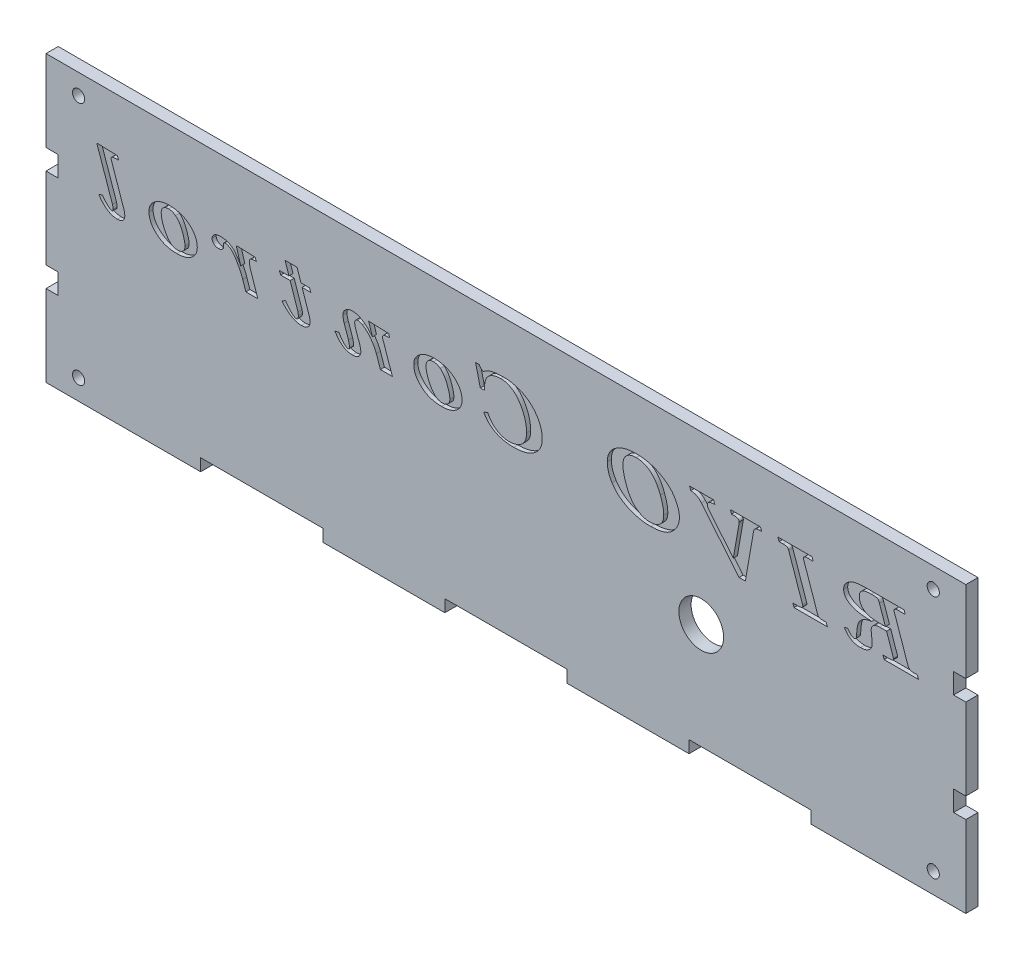
from build123d import *

# Parameters (mm, degrees)
SKETCH1_W           = 220
SKETCH1_H           = 70
BOSS_EXTRUDE1_DEPTH = 3
SKETCH2_R           = 1.5
CUT_EXTRUDE1_DEPTH  = 1
SKETCH2_2_R         = 1.5
CUT_EXTRUDE2_DEPTH  = 231.887418579
SKETCH3_W           = 3
SKETCH3_H           = 20
BOSS_EXTRUDE4_DEPTH = 3
LPATTERN1_COUNT     = 2
LPATTERN1_PITCH     = 25
LPATTERN1_COL_COUNT = 2
LPATTERN1_COL_PITCH = 25
SKETCH4_W           = 30
SKETCH4_H           = 3
CUT_EXTRUDE3_DEPTH  = 234.747727388
SKETCH5_R           = 5.5
CUT_EXTRUDE4_DEPTH  = 234.747727387


with BuildPart() as part:
    # Sketch1 → Boss-Extrude1 (new body)
    with BuildSketch(Plane.XY):
        with Locations((110, 35)):
            Rectangle(SKETCH1_W, SKETCH1_H)
    extrude(amount=BOSS_EXTRUDE1_DEPTH)

    # Sketch2 → Cut-Extrude1 (cut)
    # profile 1 of 15: a face of its own
    with BuildSketch(Plane.XY.offset(3)):
        with Locations((5, 65)):
            Circle(SKETCH2_R)
    # profile 2 of 15: a face of its own
    with BuildSketch(Plane.XY.offset(3)):
        with Locations((215, 65)):
            Circle(SKETCH2_R)
    # profile 3 of 15: a face of its own
    with BuildSketch(Plane.XY.offset(3)):
        with Locations((215, 5)):
            Circle(SKETCH2_R)
    # profile 4 of 15: a face of its own
    with BuildSketch(Plane.XY.offset(3)):
        with Locations((5, 5)):
            Circle(SKETCH2_R)
    # profile 5 of 15: a face of its own
    with BuildSketch(Plane.XY.offset(3)):
        with BuildLine():
            Line((14.551689621, 57.039686415), (9.471122698, 57.206861882))
            Line((9.471122698, 57.206861882), (13.323994786, 46.074020636))
            add(Edge.make_bspline(
                [(13.323994786, 46.074020636), (13.352411728, 45.96897658), (13.404520683, 45.776354301), (13.456120583, 45.508650843), (13.499697389, 45.291750303), (13.504672708, 45.161667665), (13.506842953, 45.104925351)],
                knots=[0, 0, 0, 0, 1.320580168, 2.421585475, 3.311492349, 4, 4, 4, 4], degree=3))
            add(Edge.make_bspline(
                [(13.506842953, 45.104925351), (13.50417644, 45.040964645), (13.499437044, 44.927282403), (13.44885079, 44.77796236), (13.345603216, 44.680755487), (13.260473983, 44.672782885), (13.216898003, 44.668701867)],
                knots=[0, 0, 0, 0, 1.297222036, 2.30565167, 3.132696397, 4, 4, 4, 4], degree=3))
            add(Edge.make_bspline(
                [(13.216898003, 44.668701867), (13.163404836, 44.673643167), (13.049421049, 44.68417214), (12.875234802, 44.745170253), (12.694402258, 44.847666007), (12.576819668, 44.935439912), (12.514238618, 44.982155868)],
                knots=[0, 0, 0, 0, 0.821691393, 1.750868447, 2.802943417, 4, 4, 4, 4], degree=3))
            add(Edge.make_bspline(
                [(12.514238618, 44.982155868), (12.375093113, 45.098833383), (12.083393549, 45.343431871), (11.675543968, 45.781980683), (11.251287255, 46.280217826), (10.984439974, 46.649269388), (10.845096066, 46.841982937)],
                knots=[0, 0, 0, 0, 0.868547279, 1.820790839, 2.862047544, 4, 4, 4, 4], degree=3))
            Line((10.845096066, 46.841982937), (9.962200632, 46.489347186))
            add(Edge.make_bspline(
                [(9.962200632, 46.489347186), (10.04913175, 46.361507738), (10.21930664, 46.111251391), (10.486554533, 45.755455925), (10.756138107, 45.42553014), (11.035993855, 45.127059823), (11.315294676, 44.852518688), (11.602231044, 44.608104761), (11.892174467, 44.391320491), (12.184819326, 44.199203824), (12.480940336, 44.036492108), (12.773432623, 43.890507439), (13.067318264, 43.770889868), (13.35907676, 43.670634817), (13.650116148, 43.595102744), (13.938860861, 43.539995719), (14.226003377, 43.503983944), (14.417497697, 43.500300931), (14.512507871, 43.498473599)],
                knots=[0, 0, 0, 0, 1.307275946, 2.559101335, 3.762156086, 4.908432785, 6.017614015, 7.072703534, 8.093310473, 9.077760244, 10.030439296, 10.949248196, 11.840831279, 12.711740014, 13.556543656, 14.38117705, 15.196818743, 16, 16, 16, 16], degree=3))
            add(Edge.make_bspline(
                [(14.512507871, 43.498473599), (14.649676191, 43.502651667), (14.911018427, 43.510612002), (15.279528765, 43.592987815), (15.603036915, 43.725697211), (15.876877332, 43.914898324), (16.09259209, 44.157414378), (16.247399147, 44.445219847), (16.340493998, 44.777120057), (16.351107101, 45.012872552), (16.356662239, 45.136270751)],
                knots=[0, 0, 0, 0, 1.175547938, 2.23973238, 3.220927403, 4.159988468, 5.07033707, 5.979795866, 6.942579371, 8, 8, 8, 8], degree=3))
            add(Edge.make_bspline(
                [(16.356662239, 45.136270751), (16.354376677, 45.247857916), (16.349824926, 45.470086386), (16.306162976, 45.800425154), (16.236498261, 46.125621279), (16.168639365, 46.336598987), (16.134632323, 46.442329086)],
                knots=[0, 0, 0, 0, 1.005668898, 2.002813329, 2.999122954, 4, 4, 4, 4], degree=3))
            Line((16.134632323, 46.442329086), (13.065395236, 55.320913646))
            add(Edge.make_bspline(
                [(13.065395236, 55.320913646), (13.039146411, 55.39239769), (12.990999581, 55.523517093), (12.979294723, 55.662554931), (12.973971152, 55.72579173)],
                knots=[0, 0, 0, 0, 1.090365615, 2, 2, 2, 2], degree=3))
            add(Edge.make_bspline(
                [(12.973971152, 55.72579173), (12.977724115, 55.762081711), (12.985150007, 55.833887766), (13.039302051, 55.934436356), (13.130818568, 56.015687331), (13.257746842, 56.085919811), (13.432464064, 56.139065205), (13.661059631, 56.179249092), (13.949668037, 56.200019899), (14.161589345, 56.202469967), (14.27741737, 56.203809081)],
                knots=[0, 0, 0, 0, 0.574062983, 1.135883696, 1.760787866, 2.490067691, 3.419720705, 4.640616689, 6.163890458, 8, 8, 8, 8], degree=3))
            Line((14.27741737, 56.203809081), (14.849470921, 56.203809081))
            Line((14.849470921, 56.203809081), (14.551689621, 57.039686415))
        make_face()
    # profile 6 of 15: a face of its own
    with BuildSketch(Plane.XY.offset(3)):
        with BuildLine():
            add(Edge.make_bspline(
                [(27.299341392, 52.860299743), (27.119006294, 52.856442777), (26.76635007, 52.848900246), (26.250028786, 52.800108785), (25.759460999, 52.713235054), (25.294187654, 52.594510965), (24.854761768, 52.439140975), (24.440753614, 52.251362113), (24.052234834, 52.028547866), (23.693254612, 51.77329749), (23.366956935, 51.492614199), (23.08097591, 51.190597449), (22.841650251, 50.867398906), (22.63896428, 50.530158652), (22.489098635, 50.169186222), (22.377369927, 49.792206917), (22.31093096, 49.396375346), (22.303510116, 49.126091566), (22.299750086, 48.989142839)],
                knots=[0, 0, 0, 0, 1.22563779, 2.396809051, 3.520493674, 4.608426224, 5.656521782, 6.684000592, 7.693965789, 8.695557622, 9.673104136, 10.615039748, 11.515697462, 12.401694697, 13.282061713, 14.164018342, 15.069735699, 16, 16, 16, 16], degree=3))
            add(Edge.make_bspline(
                [(22.299750086, 48.989142839), (22.304983851, 48.813757232), (22.315364051, 48.465912464), (22.407633188, 47.951841742), (22.558568699, 47.453555991), (22.762329469, 46.965501135), (23.031930648, 46.495105771), (23.358307753, 46.037449751), (23.745560832, 45.596473204), (24.182684459, 45.16992251), (24.669979428, 44.778754022), (25.197717418, 44.432625681), (25.766786747, 44.145824842), (26.370472338, 43.906987487), (27.013291377, 43.725204165), (27.69092997, 43.591729023), (28.406750768, 43.512845464), (28.896017975, 43.503334929), (29.146107877, 43.498473599)],
                knots=[0, 0, 0, 0, 0.863540575, 1.712672307, 2.563622542, 3.424890568, 4.31241331, 5.228986642, 6.18984498, 7.200063901, 8.234475782, 9.263688751, 10.303521339, 11.368585259, 12.457519362, 13.58991351, 14.768079515, 16, 16, 16, 16], degree=3))
            add(Edge.make_bspline(
                [(29.146107877, 43.498473599), (29.329047724, 43.502361625), (29.686903288, 43.509967138), (30.210259114, 43.558282688), (30.705639855, 43.646020099), (31.175818836, 43.761445792), (31.618722944, 43.91652423), (32.034687138, 44.104662803), (32.425197228, 44.324717466), (32.78326522, 44.579588588), (33.106663291, 44.860811699), (33.39152666, 45.162574073), (33.633860098, 45.483832009), (33.828079512, 45.827219114), (33.981426583, 46.188106811), (34.090942363, 46.568580721), (34.158304229, 46.968448538), (34.165533876, 47.241370539), (34.169208233, 47.380078971)],
                knots=[0, 0, 0, 0, 1.236531547, 2.418826196, 3.54791389, 4.63410273, 5.68753004, 6.714707205, 7.716191271, 8.712265994, 9.679982411, 10.608410966, 11.512344189, 12.392654912, 13.268172565, 14.156570212, 15.063105018, 16, 16, 16, 16], degree=3))
            add(Edge.make_bspline(
                [(34.169208233, 47.380078971), (34.165715794, 47.500336858), (34.158735954, 47.740679181), (34.117253016, 48.098401287), (34.043379697, 48.451466756), (33.93767615, 48.798322223), (33.806432844, 49.142422202), (33.648162154, 49.482551905), (33.45439646, 49.815009562), (33.237413753, 50.142138636), (32.993919217, 50.456558057), (32.734173837, 50.758432522), (32.450401428, 51.037760476), (32.149601488, 51.298525416), (31.833234231, 51.544025121), (31.493513019, 51.765270619), (31.137608663, 51.971728046), (30.762464337, 52.156463147), (30.374435914, 52.324384917), (29.971236032, 52.468044121), (29.554787155, 52.587786787), (29.126577468, 52.686550365), (28.687388906, 52.765863804), (28.235522617, 52.81948397), (27.771841794, 52.855156929), (27.45787782, 52.858574193), (27.299341392, 52.860299743)],
                knots=[0, 0, 0, 0, 0.888317552, 1.775353847, 2.655721043, 3.548890605, 4.450631694, 5.374125356, 6.316174758, 7.290042599, 8.271482707, 9.251552309, 10.229255916, 11.209325518, 12.190765627, 13.184267925, 14.201302937, 15.228051197, 16.270925968, 17.322567865, 18.387030847, 19.469658163, 20.567158265, 21.681505567, 22.829273875, 24, 24, 24, 24], degree=3))
        make_face()
        with BuildLine():
            add(Edge.make_bspline(
                [(27.147838625, 52.024422409), (27.224547179, 52.022245435), (27.376753691, 52.017925843), (27.601398285, 51.988589269), (27.81975543, 51.941195605), (28.032753464, 51.876320765), (28.239272879, 51.788931018), (28.440443951, 51.68463526), (28.636092034, 51.561398582), (28.757757506, 51.464862926), (28.819593294, 51.415799225)],
                knots=[0, 0, 0, 0, 1.013785412, 2.011571518, 2.988973338, 3.964544117, 4.949841126, 5.948423338, 6.957297764, 8, 8, 8, 8], degree=3))
            add(Edge.make_bspline(
                [(28.819593294, 51.415799225), (28.904360487, 51.342187864), (29.07657731, 51.192635729), (29.317195786, 50.940326337), (29.544483684, 50.658911326), (29.761752416, 50.35050125), (29.965064324, 50.011775987), (30.157398871, 49.645842171), (30.341536207, 49.253492391), (30.506062948, 48.839377633), (30.657592116, 48.423546451), (30.791197205, 48.021204768), (30.904513537, 47.639821353), (30.994656615, 47.27948832), (31.071401349, 46.941472166), (31.11867476, 46.62345724), (31.153566833, 46.327287124), (31.157945956, 46.13680242), (31.16004983, 46.045287352)],
                knots=[0, 0, 0, 0, 0.898298403, 1.825023227, 2.786175257, 3.791663527, 4.842322108, 5.945990988, 7.099669882, 8.309778945, 9.51140849, 10.642057629, 11.70283884, 12.695099624, 13.615117063, 14.475661657, 15.267658119, 16, 16, 16, 16], degree=3))
            add(Edge.make_bspline(
                [(31.16004983, 46.045287352), (31.158589278, 45.978181261), (31.155753432, 45.847886234), (31.132488744, 45.657781129), (31.090530506, 45.480255903), (31.033372016, 45.314466538), (30.959179019, 45.161394136), (30.870633138, 45.019712058), (30.764501162, 44.88976351), (30.60106744, 44.734481067), (30.363287382, 44.570757317), (30.035908868, 44.430919648), (29.66713415, 44.350554009), (29.408590239, 44.339895334), (29.274101594, 44.334350934)],
                knots=[0, 0, 0, 0, 0.837908338, 1.626905794, 2.38650819, 3.11211736, 3.812436167, 4.506309664, 5.194107319, 5.901648696, 7.316271823, 8.772613992, 10.321187426, 12, 12, 12, 12], degree=3))
            add(Edge.make_bspline(
                [(29.274101594, 44.334350934), (29.142096367, 44.338612722), (28.883118868, 44.346973808), (28.509407823, 44.43518718), (28.156570642, 44.569483528), (27.946052396, 44.703229118), (27.840049543, 44.770574418)],
                knots=[0, 0, 0, 0, 1.038900749, 2.038191385, 3.012164901, 4, 4, 4, 4], degree=3))
            add(Edge.make_bspline(
                [(27.840049543, 44.770574418), (27.764070075, 44.829353958), (27.607180612, 44.950727413), (27.385257982, 45.165125121), (27.16557275, 45.411563384), (26.949968672, 45.692007391), (26.735369527, 46.002680335), (26.527024401, 46.347736027), (26.317918937, 46.722387925), (26.118229088, 47.124916397), (25.929298074, 47.537765257), (25.764860873, 47.952241627), (25.622063244, 48.358305372), (25.510617078, 48.759410763), (25.421373734, 49.151625678), (25.354227378, 49.535786397), (25.317498881, 49.913976343), (25.311754654, 50.163653947), (25.30890849, 50.287364824)],
                knots=[0, 0, 0, 0, 0.739100351, 1.526163063, 2.371207367, 3.278957214, 4.247697677, 5.276630592, 6.380869678, 7.550018524, 8.735009959, 9.875225442, 10.981822192, 12.047165739, 13.07817094, 14.07770823, 15.047538117, 16, 16, 16, 16], degree=3))
            add(Edge.make_bspline(
                [(25.30890849, 50.287364824), (25.310428169, 50.353592145), (25.313397619, 50.483000205), (25.336056261, 50.671487697), (25.379272234, 50.848690285), (25.435663453, 51.015422878), (25.508860927, 51.170915521), (25.599997687, 51.313366696), (25.703257036, 51.448076424), (25.868214377, 51.605891101), (26.100239932, 51.776759545), (26.419718473, 51.920773328), (26.773019496, 52.009562334), (27.020172324, 52.019360952), (27.147838625, 52.024422409)],
                knots=[0, 0, 0, 0, 0.836317723, 1.634163236, 2.391584907, 3.13572098, 3.853811406, 4.555466211, 5.268148489, 5.991272321, 7.431866059, 8.883329201, 10.390089908, 12, 12, 12, 12], degree=3))
        make_face(mode=Mode.SUBTRACT)
    # profile 7 of 15: a face of its own
    with BuildSketch(Plane.XY.offset(3)):
        with BuildLine():
            Line((48.371808989, 52.358773343), (43.740526134, 52.52594881))
            Line((43.740526134, 52.52594881), (44.858512069, 48.743603872))
            add(Edge.make_bspline(
                [(44.858512069, 48.743603872), (44.767158385, 48.913043403), (44.59117947, 49.239442773), (44.321509651, 49.703097168), (44.05843721, 50.124519168), (43.799658991, 50.502945107), (43.550629038, 50.841656786), (43.304197189, 51.135201875), (43.06559273, 51.3881975), (42.899660726, 51.532775121), (42.821061066, 51.601259509)],
                knots=[0, 0, 0, 0, 1.308934308, 2.521461963, 3.646775877, 4.686328269, 5.638415768, 6.504164063, 7.291443531, 8, 8, 8, 8], degree=3))
            add(Edge.make_bspline(
                [(42.821061066, 51.601259509), (42.71341655, 51.675418515), (42.499160436, 51.823024924), (42.158098725, 52.009854168), (41.807232875, 52.169859451), (41.445328416, 52.30237897), (41.070369576, 52.39950042), (40.685977447, 52.474571917), (40.289072332, 52.515753368), (40.02095791, 52.522519059), (39.88504193, 52.52594881)],
                knots=[0, 0, 0, 0, 1.001788886, 1.993964955, 2.976955787, 3.956926391, 4.944802578, 5.943895814, 6.957693459, 8, 8, 8, 8], degree=3))
            add(Edge.make_bspline(
                [(39.88504193, 52.52594881), (39.734861482, 52.52253479), (39.448897506, 52.516034033), (39.044836004, 52.437630769), (38.684784931, 52.318390818), (38.425986894, 52.167434544), (38.243955066, 52.031445572), (38.129727971, 51.918516896), (38.031843983, 51.800773512), (37.951723722, 51.675450716), (37.888678492, 51.542222151), (37.844697672, 51.400631198), (37.817264447, 51.252304555), (37.814858902, 51.151226667), (37.813633411, 51.099733108)],
                knots=[0, 0, 0, 0, 1.923675167, 3.662938871, 5.259502594, 6.76535571, 7.482429017, 8.169564703, 8.820241742, 9.443000614, 10.072533134, 10.704833713, 11.340184861, 12, 12, 12, 12], degree=3))
            add(Edge.make_bspline(
                [(37.813633411, 51.099733108), (37.818627766, 51.002333856), (37.828436199, 50.811051069), (37.922174884, 50.538683308), (38.071755222, 50.292556438), (38.277269688, 50.08150626), (38.516078975, 49.905092629), (38.782926386, 49.77748738), (39.069096062, 49.698839457), (39.267212076, 49.688975936), (39.367842829, 49.683965873)],
                knots=[0, 0, 0, 0, 0.99890432, 1.961752269, 2.926264607, 3.93975457, 4.971478111, 5.964827329, 6.966257429, 8, 8, 8, 8], degree=3))
            add(Edge.make_bspline(
                [(39.367842829, 49.683965873), (39.454426604, 49.686939584), (39.622686361, 49.692718448), (39.864263917, 49.753353265), (40.087511667, 49.846708968), (40.283223856, 49.980085887), (40.449100675, 50.135650392), (40.567668066, 50.316616513), (40.642470273, 50.513343082), (40.651220701, 50.651550012), (40.655616347, 50.720976191)],
                knots=[0, 0, 0, 0, 1.131157922, 2.198198871, 3.239797426, 4.282953722, 5.282420346, 6.195990057, 7.093782652, 8, 8, 8, 8], degree=3))
            add(Edge.make_bspline(
                [(40.655616347, 50.720976191), (40.655616347, 50.807176041), (40.655616347, 50.990024208), (40.655616347, 51.172872375), (40.655616347, 51.269520692)],
                knots=[0, 0, 0, 0, 0.942857143, 2, 2, 2, 2], degree=3))
            add(Edge.make_bspline(
                [(40.655616347, 51.269520692), (40.655616347, 51.299995386), (40.655616347, 51.353108425), (40.655616347, 51.406221464), (40.655616347, 51.428859809)],
                knots=[0, 0, 0, 0, 1.147540984, 2, 2, 2, 2], degree=3))
            add(Edge.make_bspline(
                [(40.655616347, 51.428859809), (40.660999079, 51.462811723), (40.672737416, 51.536852002), (40.768309261, 51.616447851), (40.886827897, 51.679943678), (40.981941437, 51.686590122), (41.031761148, 51.690071475)],
                knots=[0, 0, 0, 0, 0.800238869, 1.74511248, 2.818907986, 4, 4, 4, 4], degree=3))
            add(Edge.make_bspline(
                [(41.031761148, 51.690071475), (41.114964897, 51.685299538), (41.290395055, 51.675238192), (41.560222868, 51.593893115), (41.850257511, 51.47253352), (42.10477411, 51.336124384), (42.319536836, 51.196138718), (42.485775412, 51.053973843), (42.661740392, 50.889926657), (42.841528282, 50.695433893), (43.02659804, 50.472005352), (43.219343845, 50.222708292), (43.415530669, 49.943631831), (43.545145291, 49.747009045), (43.612532417, 49.644784123)],
                knots=[0, 0, 0, 0, 0.873552962, 1.841834489, 2.941761573, 4.178677339, 4.87181004, 5.632499255, 6.474396829, 7.400611742, 8.414469194, 9.524067736, 10.712753556, 12, 12, 12, 12], degree=3))
            add(Edge.make_bspline(
                [(43.612532417, 49.644784123), (43.790896977, 49.355036281), (44.143264586, 48.782625738), (44.607265841, 47.900736316), (45.011600593, 47.014593293), (45.230689296, 46.411662365), (45.339141536, 46.113202386)],
                knots=[0, 0, 0, 0, 1.036059318, 2.046784102, 3.033128423, 4, 4, 4, 4], degree=3))
            Line((45.339141536, 46.113202386), (46.109715954, 43.832824533))
            Line((46.109715954, 43.832824533), (49.048347207, 43.832824533))
            Line((49.048347207, 43.832824533), (47.436671222, 48.568592055))
            add(Edge.make_bspline(
                [(47.436671222, 48.568592055), (47.399383178, 48.676325921), (47.327229902, 48.884793586), (47.234236909, 49.19111426), (47.151350485, 49.478692502), (47.086741179, 49.750934771), (47.033822275, 50.005063993), (46.996331008, 50.242088598), (46.974787303, 50.461974738), (46.970947509, 50.603390293), (46.969102338, 50.671345974)],
                knots=[0, 0, 0, 0, 1.264741701, 2.447306107, 3.55134569, 4.584650432, 5.550886558, 6.43078146, 7.245929383, 8, 8, 8, 8], degree=3))
            add(Edge.make_bspline(
                [(46.969102338, 50.671345974), (46.972958673, 50.75437591), (46.980093193, 50.907987725), (47.035376739, 51.120843499), (47.139127309, 51.288863091), (47.262538223, 51.391810524), (47.384565778, 51.448949409), (47.500067663, 51.488005237), (47.639613049, 51.517739528), (47.801805036, 51.543461997), (47.987391835, 51.564665266), (48.197541583, 51.576173173), (48.430945505, 51.584940499), (48.59470004, 51.583648172), (48.680038756, 51.582974692)],
                knots=[0, 0, 0, 0, 1.329184474, 2.459094287, 3.480297262, 4.440682147, 4.983170159, 5.631288918, 6.388922003, 7.264501657, 8.260652442, 9.378194237, 10.6336773, 12, 12, 12, 12], degree=3))
            Line((48.680038756, 51.582974692), (48.371808989, 52.358773343))
        make_face()
    # profile 8 of 15: a face of its own
    with BuildSketch(Plane.XY.offset(3)):
        with BuildLine():
            Line((58.674519558, 55.367931746), (55.738500421, 55.367931746))
            Line((55.738500421, 55.367931746), (56.694535122, 52.52594881))
            Line((56.694535122, 52.52594881), (54.317508953, 52.52594881))
            Line((54.317508953, 52.52594881), (54.67275682, 51.690071475))
            Line((54.67275682, 51.690071475), (56.979255839, 51.690071475))
            Line((56.979255839, 51.690071475), (58.906997941, 45.972148086))
            add(Edge.make_bspline(
                [(58.906997941, 45.972148086), (58.933327063, 45.843722621), (58.984761684, 45.592840147), (58.993941373, 45.336932135), (58.998422025, 45.212022135)],
                knots=[0, 0, 0, 0, 1.023789842, 2, 2, 2, 2], degree=3))
            add(Edge.make_bspline(
                [(58.998422025, 45.212022135), (58.997469261, 45.143111962), (58.995688173, 45.014291934), (58.968703256, 44.83486333), (58.929722942, 44.68130606), (58.868818364, 44.555450711), (58.793323661, 44.456802318), (58.704379817, 44.386371451), (58.603742211, 44.340362955), (58.53134967, 44.336386793), (58.494283508, 44.334350934)],
                knots=[0, 0, 0, 0, 1.464318973, 2.73738411, 3.851806852, 4.821004614, 5.691751274, 6.46990972, 7.216568822, 8, 8, 8, 8], degree=3))
            add(Edge.make_bspline(
                [(58.494283508, 44.334350934), (58.454953896, 44.336695308), (58.373602342, 44.341544543), (58.24867027, 44.372146074), (58.118736049, 44.422718844), (57.981319812, 44.491644549), (57.838778881, 44.581020383), (57.688720711, 44.689217166), (57.533143839, 44.81718302), (57.370295815, 44.964640086), (57.201580691, 45.131413891), (57.02567544, 45.317943003), (56.84418045, 45.524721613), (56.652048353, 45.747742734), (56.460764891, 45.996214992), (56.255363139, 46.258329337), (56.047601218, 46.543210259), (55.908850138, 46.740765349), (55.837760855, 46.841982937)],
                knots=[0, 0, 0, 0, 0.504540702, 1.043620015, 1.64097657, 2.29025811, 3.012387114, 3.796535341, 4.661675592, 5.59472022, 6.613458126, 7.703695725, 8.882486672, 10.142292464, 11.478349101, 12.903525385, 14.413517499, 16, 16, 16, 16], degree=3))
            Line((55.837760855, 46.841982937), (54.999271404, 46.345680769))
            add(Edge.make_bspline(
                [(54.999271404, 46.345680769), (55.09225914, 46.226413823), (55.275208597, 45.991761127), (55.56243398, 45.66089734), (55.853083524, 45.354536942), (56.145867605, 45.071090678), (56.442848276, 44.812510716), (56.744331697, 44.579636652), (57.047871978, 44.369059985), (57.355649529, 44.184435705), (57.662972792, 44.022916598), (57.967444042, 43.883679358), (58.268207767, 43.76563934), (58.566453885, 43.66852208), (58.862201076, 43.5925146), (59.154323739, 43.536978431), (59.443490745, 43.504759245), (59.634831786, 43.500558751), (59.729814692, 43.498473599)],
                knots=[0, 0, 0, 0, 1.269902568, 2.498479848, 3.677781506, 4.81549835, 5.919560655, 6.982892565, 8.013280144, 9.020284053, 9.994990875, 10.927561575, 11.830565535, 12.706975986, 13.56004427, 14.393295013, 15.202421454, 16, 16, 16, 16], degree=3))
            add(Edge.make_bspline(
                [(59.729814692, 43.498473599), (59.810867904, 43.499802328), (59.968976611, 43.502394249), (60.199110265, 43.527632589), (60.417409861, 43.561652053), (60.621063481, 43.618361957), (60.813376979, 43.68492341), (60.990952673, 43.769754511), (61.158277149, 43.865612708), (61.307814003, 43.981284098), (61.444696147, 44.105920204), (61.563136998, 44.242645456), (61.662507417, 44.389385755), (61.744027262, 44.54442503), (61.807945878, 44.708157557), (61.850587068, 44.88127351), (61.882131987, 45.062864225), (61.883904769, 45.18749672), (61.884810945, 45.251203885)],
                knots=[0, 0, 0, 0, 1.244383984, 2.427392293, 3.553073846, 4.633352713, 5.669692395, 6.674754656, 7.651845416, 8.625452123, 9.57185877, 10.491525084, 11.396587146, 12.287909707, 13.17702229, 14.088484109, 15.022909239, 16, 16, 16, 16], degree=3))
            add(Edge.make_bspline(
                [(61.884810945, 45.251203885), (61.882492457, 45.350627684), (61.877774629, 45.552942497), (61.832194676, 45.857269433), (61.769023028, 46.169037101), (61.70391358, 46.374054993), (61.670617378, 46.47889872)],
                knots=[0, 0, 0, 0, 0.952779933, 1.938786236, 2.945919648, 4, 4, 4, 4], degree=3))
            Line((61.670617378, 46.47889872), (59.915274976, 51.690071475))
            Line((59.915274976, 51.690071475), (62.096392395, 51.690071475))
            Line((62.096392395, 51.690071475), (61.743756645, 52.52594881))
            Line((61.743756645, 52.52594881), (59.633166376, 52.52594881))
            Line((59.633166376, 52.52594881), (58.674519558, 55.367931746))
        make_face()
    # profile 9 of 15: a face of its own
    with BuildSketch(Plane.XY.offset(3)):
        with BuildLine():
            Line((68.961557426, 46.67480747), (68.005522725, 46.431880619))
            add(Edge.make_bspline(
                [(68.005522725, 46.431880619), (68.075550198, 46.308291573), (68.212855889, 46.065965546), (68.438162292, 45.723286647), (68.673454949, 45.407964083), (68.914411945, 45.115450286), (69.164810083, 44.848361475), (69.426208809, 44.607801729), (69.696500864, 44.392990824), (69.972552402, 44.201648579), (70.256072397, 44.037622687), (70.540648785, 43.894403498), (70.825247476, 43.76875546), (71.115037411, 43.674289961), (71.403776628, 43.593749895), (71.694953025, 43.54031289), (71.986321488, 43.503685363), (72.181313412, 43.500212472), (72.278945597, 43.498473599)],
                knots=[0, 0, 0, 0, 1.251828656, 2.454510936, 3.611869784, 4.718336289, 5.793346919, 6.836207262, 7.846623055, 8.834400209, 9.793987353, 10.730996468, 11.641997258, 12.532696194, 13.415156968, 14.282164015, 15.13988192, 16, 16, 16, 16], degree=3))
            add(Edge.make_bspline(
                [(72.278945597, 43.498473599), (72.358221626, 43.500140602), (72.512700459, 43.503388958), (72.738053877, 43.523896502), (72.950448448, 43.560068455), (73.148680442, 43.612265538), (73.334180756, 43.678104335), (73.506645591, 43.757863801), (73.663997233, 43.856071994), (73.808392124, 43.965258445), (73.936528269, 44.087877413), (74.047074522, 44.222579811), (74.141592701, 44.367112823), (74.220774192, 44.52165599), (74.28069917, 44.686757923), (74.32221601, 44.862101259), (74.349442079, 45.047472851), (74.351773725, 45.175352218), (74.352966233, 45.240755418)],
                knots=[0, 0, 0, 0, 1.242169857, 2.420516678, 3.541968653, 4.614123133, 5.628197633, 6.623000552, 7.584697459, 8.528815158, 9.455120532, 10.356475475, 11.253276, 12.1562814, 13.071265288, 13.997771574, 14.975971268, 16, 16, 16, 16], degree=3))
            add(Edge.make_bspline(
                [(74.352966233, 45.240755418), (74.35131924, 45.303512353), (74.347855019, 45.435512916), (74.322102681, 45.643007881), (74.283592332, 45.870873827), (74.223796864, 46.118371145), (74.15385306, 46.387876263), (74.068149659, 46.67760366), (73.961766142, 46.985614501), (73.885635916, 47.197318916), (73.846215599, 47.306939704)],
                knots=[0, 0, 0, 0, 0.704730607, 1.482303691, 2.345668163, 3.299301438, 4.340616617, 5.473090934, 6.691563596, 8, 8, 8, 8], degree=3))
            add(Edge.make_bspline(
                [(73.846215599, 47.306939704), (73.787920353, 47.468035294), (73.677328928, 47.773648396), (73.519896707, 48.206695077), (73.383876688, 48.591799565), (73.267102241, 48.928157368), (73.166180083, 49.215510976), (73.088610273, 49.455540339), (73.028331016, 49.646152631), (72.971604266, 49.832217387), (72.92704587, 50.02877214), (72.882815852, 50.245096535), (72.85880751, 50.449635887), (72.855301279, 50.581611937), (72.853611264, 50.645224808)],
                knots=[0, 0, 0, 0, 1.764122366, 3.346701849, 4.744723696, 5.969679202, 7.013120823, 7.880732494, 8.566961968, 9.071926962, 9.88308229, 10.640954182, 11.344935645, 12, 12, 12, 12], degree=3))
            add(Edge.make_bspline(
                [(72.853611264, 50.645224808), (72.85579943, 50.709903154), (72.859984418, 50.833604087), (72.900115893, 51.00735931), (72.962112915, 51.161612162), (73.054488651, 51.289543786), (73.165227386, 51.390932889), (73.286671439, 51.472027116), (73.427568324, 51.512888067), (73.524716555, 51.519502617), (73.574555465, 51.522896009)],
                knots=[0, 0, 0, 0, 1.217555655, 2.328642857, 3.343917921, 4.332429815, 5.273312955, 6.165988551, 7.05911686, 8, 8, 8, 8], degree=3))
            add(Edge.make_bspline(
                [(73.574555465, 51.522896009), (73.670751222, 51.518201151), (73.867362071, 51.508605511), (74.164598155, 51.432552965), (74.469090042, 51.31197485), (74.665950296, 51.199828778), (74.768292783, 51.141526975)],
                knots=[0, 0, 0, 0, 0.909343586, 1.858572773, 2.886728108, 4, 4, 4, 4], degree=3))
            add(Edge.make_bspline(
                [(74.768292783, 51.141526975), (74.855944673, 51.087576679), (75.033515686, 50.978280589), (75.292517717, 50.795248031), (75.545411169, 50.589958465), (75.79744219, 50.367884351), (76.044440942, 50.124134782), (76.291202827, 49.86351452), (76.530410394, 49.580091569), (76.844636678, 49.183364476), (77.209742222, 48.670220746), (77.586962531, 48.031831119), (77.918419657, 47.390512121), (78.086291975, 46.946512169), (78.169268687, 46.727049803)],
                knots=[0, 0, 0, 0, 0.653204802, 1.323305622, 2.011220133, 2.719868556, 3.45460932, 4.213118867, 4.997210866, 5.807698757, 7.425449128, 8.989361705, 10.511887675, 12, 12, 12, 12], degree=3))
            Line((78.169268687, 46.727049803), (79.164485138, 43.832824533))
            Line((79.164485138, 43.832824533), (82.105728508, 43.832824533))
            Line((82.105728508, 43.832824533), (79.720865989, 50.726200424))
            add(Edge.make_bspline(
                [(79.720865989, 50.726200424), (79.710631225, 50.771285214), (79.690715038, 50.859017286), (79.688153605, 50.948929336), (79.686908472, 50.992636325)],
                knots=[0, 0, 0, 0, 1.027783523, 2, 2, 2, 2], degree=3))
            add(Edge.make_bspline(
                [(79.686908472, 50.992636325), (79.690033342, 51.046020031), (79.695980665, 51.147621092), (79.738017876, 51.291824642), (79.813269946, 51.414584281), (79.920181582, 51.519546282), (80.07064299, 51.59955041), (80.267883146, 51.653946767), (80.515649718, 51.686084063), (80.69768711, 51.68866344), (80.797058057, 51.690071475)],
                knots=[0, 0, 0, 0, 0.855917329, 1.62900093, 2.380987736, 3.14135528, 4.003967099, 5.082005799, 6.407119304, 8, 8, 8, 8], degree=3))
            Line((80.797058057, 51.690071475), (81.379560074, 51.690071475))
            Line((81.379560074, 51.690071475), (81.285523874, 52.52594881))
            Line((81.285523874, 52.52594881), (76.275484101, 52.693124277))
            Line((76.275484101, 52.693124277), (77.210621869, 49.822408057))
            add(Edge.make_bspline(
                [(77.210621869, 49.822408057), (77.108657915, 49.94583351), (76.90850535, 50.188114436), (76.600981029, 50.533185025), (76.290814883, 50.851195646), (75.987419635, 51.150900481), (75.679640741, 51.421415744), (75.378382126, 51.674174748), (75.074134403, 51.898996395), (74.771427139, 52.100083699), (74.470306885, 52.279024086), (74.16946405, 52.433732889), (73.86918901, 52.564259511), (73.570186138, 52.672608748), (73.272376967, 52.755909643), (72.975875864, 52.81759383), (72.679377883, 52.851277301), (72.481895278, 52.857297878), (72.383430264, 52.860299743)],
                knots=[0, 0, 0, 0, 1.304719421, 2.561129976, 3.765564543, 4.924769583, 6.035615979, 7.104108714, 8.12881763, 9.116823579, 10.064878729, 10.982076299, 11.871936912, 12.7316337, 13.571868498, 14.390182196, 15.197343309, 16, 16, 16, 16], degree=3))
            add(Edge.make_bspline(
                [(72.383430264, 52.860299743), (72.296271051, 52.859294841), (72.124929374, 52.857319358), (71.87529972, 52.827112678), (71.637279543, 52.781949382), (71.410379006, 52.724657512), (71.19684748, 52.64156383), (70.996036658, 52.542432996), (70.80613681, 52.427530427), (70.632328698, 52.293927684), (70.472846854, 52.149074929), (70.334302902, 51.991747904), (70.21517125, 51.826050236), (70.117641984, 51.651075708), (70.045452725, 51.465841515), (69.988484136, 51.274140396), (69.957486889, 51.071139634), (69.953554846, 50.932653496), (69.951549644, 50.862030491)],
                knots=[0, 0, 0, 0, 1.188682088, 2.336767115, 3.425009085, 4.494209848, 5.524683847, 6.544900694, 7.547460688, 8.547906318, 9.531775706, 10.482961838, 11.402836684, 12.312215969, 13.207987815, 14.11051082, 15.036427727, 16, 16, 16, 16], degree=3))
            add(Edge.make_bspline(
                [(69.951549644, 50.862030491), (69.956291741, 50.74168159), (69.966166829, 50.491063365), (70.027136753, 50.101184521), (70.126442295, 49.683886188), (70.219326821, 49.400364358), (70.267615761, 49.252966623)],
                knots=[0, 0, 0, 0, 0.877134263, 1.826571168, 2.8700747, 4, 4, 4, 4], degree=3))
            Line((70.267615761, 49.252966623), (71.317686662, 46.225523403))
            add(Edge.make_bspline(
                [(71.317686662, 46.225523403), (71.340555711, 46.134157658), (71.384040743, 45.960427552), (71.442335109, 45.712410779), (71.487177169, 45.490397562), (71.531443548, 45.296237675), (71.562540937, 45.128019686), (71.583604048, 44.985060918), (71.597623676, 44.869217009), (71.600970563, 44.800202367), (71.602407379, 44.770574418)],
                knots=[0, 0, 0, 0, 1.522723292, 2.895427374, 4.118505542, 5.184273336, 6.114739369, 6.88319294, 7.520555329, 8, 8, 8, 8], degree=3))
            add(Edge.make_bspline(
                [(71.602407379, 44.770574418), (71.599622502, 44.706422939), (71.594665785, 44.592241704), (71.532673304, 44.441630783), (71.414191301, 44.348385584), (71.320120845, 44.339186721), (71.270668562, 44.334350934)],
                knots=[0, 0, 0, 0, 1.237335309, 2.20229488, 3.054957031, 4, 4, 4, 4], degree=3))
            add(Edge.make_bspline(
                [(71.270668562, 44.334350934), (71.202119689, 44.338975573), (71.059573332, 44.348592441), (70.847900339, 44.429404273), (70.63009847, 44.551197354), (70.494114134, 44.661976992), (70.421730645, 44.720944201)],
                knots=[0, 0, 0, 0, 0.862114692, 1.79275459, 2.825099066, 4, 4, 4, 4], degree=3))
            add(Edge.make_bspline(
                [(70.421730645, 44.720944201), (70.294537515, 44.842951169), (70.027462452, 45.099136536), (69.662131782, 45.555497401), (69.297927727, 46.083098667), (69.076961008, 46.471801096), (68.961557426, 46.67480747)],
                knots=[0, 0, 0, 0, 0.862485891, 1.811013488, 2.856765018, 4, 4, 4, 4], degree=3))
        make_face()
    # profile 10 of 15: a face of its own
    with BuildSketch(Plane.XY.offset(3)):
        with BuildLine():
            add(Edge.make_bspline(
                [(92.364033093, 52.860299743), (92.183697995, 52.856442777), (91.831041771, 52.848900246), (91.314720487, 52.800108785), (90.8241527, 52.713235054), (90.358879355, 52.594510965), (89.919453469, 52.439140975), (89.505445315, 52.251362113), (89.116926535, 52.028547866), (88.757946313, 51.77329749), (88.431648636, 51.492614199), (88.145667611, 51.190597449), (87.906341952, 50.867398906), (87.703655982, 50.530158652), (87.553790336, 50.169186222), (87.442061628, 49.792206917), (87.375622661, 49.396375346), (87.368201817, 49.126091566), (87.364441787, 48.989142839)],
                knots=[0, 0, 0, 0, 1.22563779, 2.396809051, 3.520493674, 4.608426224, 5.656521782, 6.684000592, 7.693965789, 8.695557622, 9.673104136, 10.615039748, 11.515697462, 12.401694697, 13.282061713, 14.164018342, 15.069735699, 16, 16, 16, 16], degree=3))
            add(Edge.make_bspline(
                [(87.364441787, 48.989142839), (87.369675552, 48.813757232), (87.380055752, 48.465912464), (87.472324889, 47.951841742), (87.6232604, 47.453555991), (87.82702117, 46.965501135), (88.096622349, 46.495105771), (88.422999454, 46.037449751), (88.810252533, 45.596473204), (89.24737616, 45.16992251), (89.734671129, 44.778754022), (90.26240912, 44.432625681), (90.831478448, 44.145824842), (91.43516404, 43.906987487), (92.077983078, 43.725204165), (92.755621671, 43.591729023), (93.471442469, 43.512845464), (93.960709676, 43.503334929), (94.210799579, 43.498473599)],
                knots=[0, 0, 0, 0, 0.863540575, 1.712672307, 2.563622542, 3.424890568, 4.31241331, 5.228986642, 6.18984498, 7.200063901, 8.234475782, 9.263688751, 10.303521339, 11.368585259, 12.457519362, 13.58991351, 14.768079515, 16, 16, 16, 16], degree=3))
            add(Edge.make_bspline(
                [(94.210799579, 43.498473599), (94.393739426, 43.502361625), (94.751594989, 43.509967138), (95.274950815, 43.558282688), (95.770331557, 43.646020099), (96.240510537, 43.761445792), (96.683414645, 43.91652423), (97.099378839, 44.104662803), (97.489888929, 44.324717466), (97.847956922, 44.579588588), (98.171354992, 44.860811699), (98.456218361, 45.162574073), (98.698551799, 45.483832009), (98.892771213, 45.827219114), (99.046118284, 46.188106811), (99.155634065, 46.568580721), (99.22299593, 46.968448538), (99.230225577, 47.241370539), (99.233899934, 47.380078971)],
                knots=[0, 0, 0, 0, 1.236531547, 2.418826196, 3.54791389, 4.63410273, 5.68753004, 6.714707205, 7.716191271, 8.712265994, 9.679982411, 10.608410966, 11.512344189, 12.392654912, 13.268172565, 14.156570212, 15.063105018, 16, 16, 16, 16], degree=3))
            add(Edge.make_bspline(
                [(99.233899934, 47.380078971), (99.230407496, 47.500336858), (99.223427655, 47.740679181), (99.181944717, 48.098401287), (99.108071398, 48.451466756), (99.002367851, 48.798322223), (98.871124545, 49.142422202), (98.712853855, 49.482551905), (98.519088161, 49.815009562), (98.302105454, 50.142138636), (98.058610918, 50.456558057), (97.798865538, 50.758432522), (97.515093129, 51.037760476), (97.214293189, 51.298525416), (96.897925932, 51.544025121), (96.55820472, 51.765270619), (96.202300365, 51.971728046), (95.827156038, 52.156463147), (95.439127615, 52.324384917), (95.035927733, 52.468044121), (94.619478856, 52.587786787), (94.19126917, 52.686550365), (93.752080607, 52.765863804), (93.300214319, 52.81948397), (92.836533495, 52.855156929), (92.522569521, 52.858574193), (92.364033093, 52.860299743)],
                knots=[0, 0, 0, 0, 0.888317552, 1.775353847, 2.655721043, 3.548890605, 4.450631694, 5.374125356, 6.316174758, 7.290042599, 8.271482707, 9.251552309, 10.229255916, 11.209325518, 12.190765627, 13.184267925, 14.201302937, 15.228051197, 16.270925968, 17.322567865, 18.387030847, 19.469658163, 20.567158265, 21.681505567, 22.829273875, 24, 24, 24, 24], degree=3))
        make_face()
        with BuildLine():
            add(Edge.make_bspline(
                [(92.212530326, 52.024422409), (92.28923888, 52.022245435), (92.441445392, 52.017925843), (92.666089987, 51.988589269), (92.884447131, 51.941195605), (93.097445165, 51.876320765), (93.30396458, 51.788931018), (93.505135652, 51.68463526), (93.700783736, 51.561398582), (93.822449207, 51.464862926), (93.884284995, 51.415799225)],
                knots=[0, 0, 0, 0, 1.013785412, 2.011571518, 2.988973338, 3.964544117, 4.949841126, 5.948423338, 6.957297764, 8, 8, 8, 8], degree=3))
            add(Edge.make_bspline(
                [(93.884284995, 51.415799225), (93.969052188, 51.342187864), (94.141269011, 51.192635729), (94.381887487, 50.940326337), (94.609175385, 50.658911326), (94.826444118, 50.35050125), (95.029756025, 50.011775987), (95.222090572, 49.645842171), (95.406227909, 49.253492391), (95.570754649, 48.839377633), (95.722283818, 48.423546451), (95.855888907, 48.021204768), (95.969205238, 47.639821353), (96.059348316, 47.27948832), (96.136093051, 46.941472166), (96.183366461, 46.62345724), (96.218258534, 46.327287124), (96.222637657, 46.13680242), (96.224741531, 46.045287352)],
                knots=[0, 0, 0, 0, 0.898298403, 1.825023227, 2.786175257, 3.791663527, 4.842322108, 5.945990988, 7.099669882, 8.309778945, 9.51140849, 10.642057629, 11.70283884, 12.695099624, 13.615117063, 14.475661657, 15.267658119, 16, 16, 16, 16], degree=3))
            add(Edge.make_bspline(
                [(96.224741531, 46.045287352), (96.22328098, 45.978181261), (96.220445133, 45.847886234), (96.197180445, 45.657781129), (96.155222208, 45.480255903), (96.098063718, 45.314466538), (96.02387072, 45.161394136), (95.935324839, 45.019712058), (95.829192863, 44.88976351), (95.665759141, 44.734481067), (95.427979083, 44.570757317), (95.100600569, 44.430919648), (94.731825852, 44.350554009), (94.47328194, 44.339895334), (94.338793295, 44.334350934)],
                knots=[0, 0, 0, 0, 0.837908338, 1.626905794, 2.38650819, 3.11211736, 3.812436167, 4.506309664, 5.194107319, 5.901648696, 7.316271823, 8.772613992, 10.321187426, 12, 12, 12, 12], degree=3))
            add(Edge.make_bspline(
                [(94.338793295, 44.334350934), (94.206788068, 44.338612722), (93.947810569, 44.346973808), (93.574099524, 44.43518718), (93.221262343, 44.569483528), (93.010744098, 44.703229118), (92.904741244, 44.770574418)],
                knots=[0, 0, 0, 0, 1.038900749, 2.038191385, 3.012164901, 4, 4, 4, 4], degree=3))
            add(Edge.make_bspline(
                [(92.904741244, 44.770574418), (92.828761776, 44.829353958), (92.671872313, 44.950727413), (92.449949683, 45.165125121), (92.230264451, 45.411563384), (92.014660373, 45.692007391), (91.800061228, 46.002680335), (91.591716102, 46.347736027), (91.382610639, 46.722387925), (91.182920789, 47.124916397), (90.993989775, 47.537765257), (90.829552574, 47.952241627), (90.686754946, 48.358305372), (90.57530878, 48.759410763), (90.486065435, 49.151625678), (90.418919079, 49.535786397), (90.382190582, 49.913976343), (90.376446355, 50.163653947), (90.373600191, 50.287364824)],
                knots=[0, 0, 0, 0, 0.739100351, 1.526163063, 2.371207367, 3.278957214, 4.247697677, 5.276630592, 6.380869678, 7.550018524, 8.735009959, 9.875225442, 10.981822192, 12.047165739, 13.07817094, 14.07770823, 15.047538117, 16, 16, 16, 16], degree=3))
            add(Edge.make_bspline(
                [(90.373600191, 50.287364824), (90.37511987, 50.353592145), (90.37808932, 50.483000205), (90.400747962, 50.671487697), (90.443963935, 50.848690285), (90.500355154, 51.015422878), (90.573552628, 51.170915521), (90.664689388, 51.313366696), (90.767948738, 51.448076424), (90.932906078, 51.605891101), (91.164931633, 51.776759545), (91.484410175, 51.920773328), (91.837711197, 52.009562334), (92.084864025, 52.019360952), (92.212530326, 52.024422409)],
                knots=[0, 0, 0, 0, 0.836317723, 1.634163236, 2.391584907, 3.13572098, 3.853811406, 4.555466211, 5.268148489, 5.991272321, 7.431866059, 8.883329201, 10.390089908, 12, 12, 12, 12], degree=3))
        make_face(mode=Mode.SUBTRACT)
    # profile 11 of 15: a face of its own
    with BuildSketch(Plane.XY.offset(3)):
        with BuildLine():
            add(Edge.make_bspline(
                [(104.44820723, 56.052306314), (104.342042085, 56.10759598), (104.132532678, 56.216706226), (103.864102999, 56.448069828), (103.635267072, 56.720775005), (103.524972434, 56.931900215), (103.468663479, 57.039686415)],
                knots=[0, 0, 0, 0, 1.009061938, 1.991312364, 2.974500448, 4, 4, 4, 4], degree=3))
            Line((103.468663479, 57.039686415), (102.543974178, 57.039686415))
            Line((102.543974178, 57.039686415), (103.714202446, 52.191597876))
            Line((103.714202446, 52.191597876), (104.717255247, 52.191597876))
            add(Edge.make_bspline(
                [(104.717255247, 52.191597876), (104.720017454, 52.344857414), (104.725340259, 52.640190347), (104.744658764, 53.067295238), (104.781174283, 53.460295006), (104.830164565, 53.820434262), (104.89277848, 54.147414232), (104.965557993, 54.442804122), (105.058799433, 54.70292901), (105.160175658, 54.934990892), (105.28162441, 55.142120946), (105.415114687, 55.335980886), (105.56361929, 55.52027063), (105.73177918, 55.688575987), (105.912586459, 55.847953414), (106.11234457, 55.98970899), (106.32509425, 56.124796092), (106.632478739, 56.288480865), (107.051716054, 56.456891368), (107.593154743, 56.60361874), (108.179030889, 56.68986523), (108.583768081, 56.700077458), (108.792157252, 56.705335481)],
                knots=[0, 0, 0, 0, 1.305064466, 2.514874571, 3.639072435, 4.664404757, 5.607983338, 6.47282425, 7.251248142, 7.95803604, 8.62559682, 9.291839122, 9.961044346, 10.637275109, 11.315129284, 12.010590913, 12.72017245, 13.459750759, 14.972666237, 16.555211745, 18.226363724, 20, 20, 20, 20], degree=3))
            add(Edge.make_bspline(
                [(108.792157252, 56.705335481), (108.911575726, 56.703080375), (109.149414087, 56.698589021), (109.505667353, 56.654165073), (109.859698969, 56.585050988), (110.211546034, 56.483260626), (110.561769447, 56.35957435), (110.908818527, 56.202259678), (111.25540136, 56.021001507), (111.598354702, 55.807969249), (111.937812774, 55.565968267), (112.264594695, 55.280772534), (112.583719061, 54.959081766), (112.892074552, 54.597088155), (113.189580513, 54.195429202), (113.479061289, 53.756806324), (113.758954023, 53.278596955), (114.027559459, 52.768701915), (114.273149841, 52.235004008), (114.49134849, 51.692786836), (114.671738371, 51.143483158), (114.82009767, 50.590478234), (114.939444841, 50.031901517), (115.021892485, 49.468256959), (115.073775917, 48.8995724), (115.079342783, 48.519072454), (115.082134192, 48.328277322)],
                knots=[0, 0, 0, 0, 0.745807869, 1.485379226, 2.23969037, 2.997426883, 3.771776468, 4.558355628, 5.376002637, 6.2139042, 7.079054902, 7.977747492, 8.920227298, 9.908015081, 10.94601631, 12.041449769, 13.190008699, 14.406724627, 15.640841984, 16.859174423, 18.05654445, 19.250833171, 20.435180355, 21.623095647, 22.808142328, 24, 24, 24, 24], degree=3))
            add(Edge.make_bspline(
                [(115.082134192, 48.328277322), (115.080720105, 48.219391833), (115.077956349, 48.006581247), (115.053703682, 47.694436967), (115.015724563, 47.397703673), (114.959952689, 47.116104203), (114.891746998, 46.849690734), (114.800366818, 46.600497749), (114.699924048, 46.364622104), (114.581786572, 46.142969177), (114.444855615, 45.937533596), (114.29551397, 45.741371877), (114.127333673, 45.560032484), (113.946552696, 45.385511737), (113.748185107, 45.223914913), (113.532862756, 45.076059725), (113.304996945, 44.93542867), (112.976017402, 44.769400907), (112.539118367, 44.595727849), (111.986177435, 44.441990702), (111.402801127, 44.353020493), (111.004048334, 44.340652632), (110.800874971, 44.334350934)],
                knots=[0, 0, 0, 0, 0.983357663, 1.921917452, 2.826209279, 3.683774935, 4.513592374, 5.307137579, 6.07854988, 6.828000962, 7.571818862, 8.306432811, 9.052368139, 9.803303284, 10.574675494, 11.360072719, 12.161258598, 12.991336874, 14.685422834, 16.398822273, 18.165120333, 20, 20, 20, 20], degree=3))
            add(Edge.make_bspline(
                [(110.800874971, 44.334350934), (110.668407293, 44.336576419), (110.405410508, 44.340994822), (110.01536666, 44.385106844), (109.631073345, 44.452438714), (109.254052073, 44.54913763), (108.882144163, 44.672962157), (108.517615563, 44.824648615), (108.158177301, 45.00222377), (107.808940639, 45.20945063), (107.468267062, 45.440636969), (107.144848285, 45.703460039), (106.834818745, 45.990541078), (106.545494384, 46.308692175), (106.269827992, 46.651837009), (106.011997312, 47.022989194), (105.769939136, 47.421542454), (105.626277511, 47.702160046), (105.553132582, 47.845035738)],
                knots=[0, 0, 0, 0, 0.952793074, 1.891642691, 2.820721441, 3.758253226, 4.68939974, 5.638788166, 6.597003517, 7.571546336, 8.558575082, 9.556577851, 10.567242765, 11.595960473, 12.647769485, 13.732263862, 14.845388249, 16, 16, 16, 16], degree=3))
            Line((105.553132582, 47.845035738), (104.55007978, 47.523745387))
            add(Edge.make_bspline(
                [(104.55007978, 47.523745387), (104.633480514, 47.367090767), (104.798649659, 47.056847576), (105.093714232, 46.624008971), (105.406699796, 46.214209769), (105.755761081, 45.839522307), (106.128306148, 45.491625397), (106.530756062, 45.173171652), (106.962571102, 44.886940931), (107.420247036, 44.627320236), (107.904380176, 44.400293488), (108.412245775, 44.205486356), (108.94121016, 44.036824403), (109.494038191, 43.902356891), (110.06854543, 43.794813043), (110.66601814, 43.719682165), (111.286038654, 43.674966601), (111.707204821, 43.668790935), (111.921473022, 43.665649066)],
                knots=[0, 0, 0, 0, 0.968724242, 1.918488583, 2.857473952, 3.783065701, 4.71189002, 5.639642132, 6.582809977, 7.539089831, 8.511415139, 9.500657939, 10.508465915, 11.542037602, 12.606403905, 13.69954035, 14.829641626, 16, 16, 16, 16], degree=3))
            add(Edge.make_bspline(
                [(111.921473022, 43.665649066), (112.184552453, 43.670436525), (112.69761238, 43.67977307), (113.445766122, 43.744297186), (114.151169194, 43.856097434), (114.813690774, 44.013099805), (115.436425002, 44.209701646), (116.01578379, 44.456473985), (116.554025857, 44.745883252), (117.044806191, 45.08086701), (117.487339767, 45.449642057), (117.872091636, 45.854780933), (118.197868526, 46.290759404), (118.467594571, 46.756247105), (118.674883734, 47.253447914), (118.820425047, 47.780900467), (118.912391208, 48.338116486), (118.922172677, 48.720597771), (118.92716993, 48.916003572)],
                knots=[0, 0, 0, 0, 1.283214801, 2.502537308, 3.659530667, 4.763868388, 5.82093603, 6.840937933, 7.831047923, 8.797015377, 9.734524655, 10.635805764, 11.515821039, 12.383460814, 13.253477817, 14.135581399, 15.047487483, 16, 16, 16, 16], degree=3))
            add(Edge.make_bspline(
                [(118.92716993, 48.916003572), (118.923213247, 49.109471951), (118.915350233, 49.493946657), (118.850379562, 50.064986477), (118.746413825, 50.625637772), (118.59888934, 51.176400079), (118.411427039, 51.717294258), (118.179288356, 52.247415116), (117.907436135, 52.767866538), (117.59502337, 53.274442479), (117.248695343, 53.760724019), (116.875398766, 54.221433069), (116.474896645, 54.650993753), (116.048295194, 55.048191521), (115.596803464, 55.416340585), (115.118904409, 55.752483037), (114.614709157, 56.059965642), (114.085990336, 56.334836393), (113.539073813, 56.579896957), (112.977892344, 56.791648452), (112.406149758, 56.972659543), (111.82220971, 57.11799496), (111.227855713, 57.234577937), (110.621428506, 57.313551765), (110.004233983, 57.36594626), (109.588961612, 57.371327862), (109.379883503, 57.374037349)],
                knots=[0, 0, 0, 0, 0.981311553, 1.95013507, 2.911842518, 3.871925321, 4.840073851, 5.813398687, 6.805282114, 7.816724976, 8.830412996, 9.832162841, 10.822943935, 11.807481585, 12.787161167, 13.776217405, 14.769437735, 15.78107351, 16.797433814, 17.808220496, 18.822524342, 19.838202826, 20.859628852, 21.893587016, 22.939479543, 24, 24, 24, 24], degree=3))
            add(Edge.make_bspline(
                [(109.379883503, 57.374037349), (109.125570378, 57.371161402), (108.633894786, 57.365601197), (107.921363593, 57.319311782), (107.260435967, 57.238339475), (106.642342367, 57.128948038), (106.055627675, 56.967400431), (105.496078859, 56.732496765), (104.953290558, 56.430496157), (104.618757905, 56.18000907), (104.44820723, 56.052306314)],
                knots=[0, 0, 0, 0, 1.17038599, 2.262762581, 3.28419828, 4.233672259, 5.149624457, 6.078399365, 7.020333944, 8, 8, 8, 8], degree=3))
        make_face()
    # profile 12 of 15: a face of its own
    with BuildSketch(Plane.XY.offset(3)):
        with BuildLine():
            add(Edge.make_bspline(
                [(141.998429203, 57.374037349), (141.737072282, 57.369488005), (141.226507344, 57.360600789), (140.48102093, 57.292455358), (139.774603176, 57.178210975), (139.10887015, 57.017293857), (138.481937351, 56.810419553), (137.896009624, 56.557287954), (137.348562508, 56.258591126), (136.846192107, 55.914556727), (136.391820474, 55.535152198), (135.99439712, 55.124543845), (135.660568891, 54.684120098), (135.381266909, 54.219244539), (135.170400791, 53.721775745), (135.017533526, 53.198665723), (134.927632876, 52.647455722), (134.915388378, 52.271160464), (134.909144562, 52.079276859)],
                knots=[0, 0, 0, 0, 1.266138232, 2.473421344, 3.623295102, 4.730368491, 5.788252509, 6.818005342, 7.818614302, 8.805009561, 9.763208543, 10.68213897, 11.567213161, 12.435397084, 13.302842756, 14.177266479, 15.070536578, 16, 16, 16, 16], degree=3))
            add(Edge.make_bspline(
                [(134.909144562, 52.079276859), (134.912615404, 51.91281486), (134.919557611, 51.5798658), (134.977103504, 51.084205475), (135.064926567, 50.593324003), (135.191652896, 50.108129335), (135.353712885, 49.627095881), (135.552550738, 49.151319125), (135.78883556, 48.681655193), (135.969550777, 48.377736065), (136.061088013, 48.223792655)],
                knots=[0, 0, 0, 0, 0.979593969, 1.959335415, 2.933483979, 3.913064539, 4.908222317, 5.919094084, 6.945963834, 8, 8, 8, 8], degree=3))
            add(Edge.make_bspline(
                [(136.061088013, 48.223792655), (136.174242087, 48.050397395), (136.40092514, 47.70303238), (136.789382436, 47.214961804), (137.21775485, 46.755179732), (137.686899879, 46.324293209), (138.194295717, 45.918521092), (138.742038575, 45.542176237), (139.329175433, 45.193752224), (139.952993495, 44.877980543), (140.603303974, 44.595071133), (141.271124554, 44.346272611), (141.952404348, 44.133408313), (142.650038506, 43.964633096), (143.360675404, 43.831384041), (144.085971017, 43.734521892), (144.825487905, 43.675482171), (145.323545702, 43.668942894), (145.574416924, 43.665649066)],
                knots=[0, 0, 0, 0, 0.903190596, 1.809373655, 2.718110434, 3.643161436, 4.58671846, 5.551131597, 6.541018998, 7.564038577, 8.600358569, 9.634370146, 10.672784876, 11.71327625, 12.764837873, 13.82673593, 14.905329028, 16, 16, 16, 16], degree=3))
            add(Edge.make_bspline(
                [(145.574416924, 43.665649066), (145.861053632, 43.670529475), (146.416226523, 43.679982106), (147.220227039, 43.756309331), (147.968698709, 43.880650045), (148.662935503, 44.053131126), (149.301025981, 44.280352586), (149.882769925, 44.558086974), (150.410519919, 44.885119844), (150.876869356, 45.264952166), (151.285272602, 45.679569421), (151.64575289, 46.109309609), (151.948876671, 46.560524804), (152.19889318, 47.027978294), (152.39007425, 47.515997986), (152.530034842, 48.018861224), (152.61246194, 48.54150511), (152.623928075, 48.895689532), (152.629744049, 49.075342689)],
                knots=[0, 0, 0, 0, 1.378653253, 2.670247357, 3.880782136, 5.025661227, 6.106732745, 7.133359903, 8.121215903, 9.086081467, 10.019027182, 10.917301991, 11.780438144, 12.629227318, 13.462244261, 14.296513347, 15.135939538, 16, 16, 16, 16], degree=3))
            add(Edge.make_bspline(
                [(152.629744049, 49.075342689), (152.626225145, 49.220059422), (152.619120412, 49.512245192), (152.560446737, 49.952951749), (152.47233384, 50.401004908), (152.346074502, 50.85572178), (152.18294078, 51.317037005), (151.982948277, 51.784534741), (151.750418733, 52.260287651), (151.482901279, 52.74044098), (151.17425343, 53.2155215), (150.816937862, 53.672686547), (150.417525398, 54.113911017), (149.974321256, 54.537074477), (149.481596387, 54.936489443), (148.948461666, 55.321210565), (148.369436619, 55.686281598), (147.752281975, 56.031905882), (147.103111169, 56.346571366), (146.429751591, 56.621917211), (145.736741556, 56.853846751), (145.025293071, 57.0458998), (144.294400584, 57.190282102), (143.546590465, 57.298702403), (142.778818137, 57.362148451), (142.260626954, 57.370042876), (141.998429203, 57.374037349)],
                knots=[0, 0, 0, 0, 0.699847659, 1.413005419, 2.147392453, 2.907692782, 3.693695454, 4.512826102, 5.366200813, 6.254417212, 7.170366302, 8.103928458, 9.058232603, 10.047374896, 11.065108805, 12.124250482, 13.22621551, 14.374634775, 15.544544284, 16.713945627, 17.891451319, 19.077716621, 20.276361351, 21.493368292, 22.731678158, 24, 24, 24, 24], degree=3))
        make_face()
        with BuildLine():
            add(Edge.make_bspline(
                [(142.01671402, 56.538160014), (142.171018466, 56.534844464), (142.476263946, 56.528285633), (142.928354036, 56.469818497), (143.370625718, 56.384065919), (143.800250999, 56.253008359), (144.219734014, 56.092328893), (144.626790103, 55.891038898), (145.023989103, 55.65639401), (145.410160513, 55.383238991), (145.783335968, 55.068691685), (146.139594778, 54.704765323), (146.482402163, 54.293645508), (146.807447159, 53.831409826), (147.122201776, 53.323748598), (147.418346186, 52.764859298), (147.704136097, 52.159618045), (147.874457902, 51.733701377), (147.96189156, 51.515059659)],
                knots=[0, 0, 0, 0, 0.888096141, 1.756834227, 2.621105018, 3.479246565, 4.339538315, 5.205029746, 6.09066009, 6.99345135, 7.925544576, 8.896936498, 9.922086549, 11.004379853, 12.148046106, 13.359267682, 14.644396207, 16, 16, 16, 16], degree=3))
            add(Edge.make_bspline(
                [(147.96189156, 51.515059659), (148.027622108, 51.339639369), (148.156350595, 50.996091518), (148.324007938, 50.482071672), (148.465694866, 49.981083432), (148.579433775, 49.492618882), (148.674257764, 49.01843869), (148.734400998, 48.556651117), (148.777160783, 48.107916012), (148.782215258, 47.812916451), (148.784708311, 47.667411804)],
                knots=[0, 0, 0, 0, 1.136309514, 2.225379367, 3.278874072, 4.293585549, 5.267341208, 6.210813917, 7.117507537, 8, 8, 8, 8], degree=3))
            add(Edge.make_bspline(
                [(148.784708311, 47.667411804), (148.782848644, 47.541874889), (148.779232829, 47.297789096), (148.732660733, 46.944004209), (148.663015068, 46.613478131), (148.567134749, 46.304209859), (148.438887265, 46.019783083), (148.283100072, 45.757574346), (148.099618093, 45.518418254), (147.88750821, 45.304166046), (147.650407474, 45.116001311), (147.393840751, 44.950032521), (147.11449039, 44.812013201), (146.815832811, 44.696236452), (146.496282427, 44.608249985), (146.156384826, 44.545389741), (145.796356006, 44.509398866), (145.549245916, 44.504189579), (145.422914157, 44.501526401)],
                knots=[0, 0, 0, 0, 1.146575431, 2.229326515, 3.254737433, 4.231214715, 5.182198281, 6.099284643, 7.012877462, 7.93006739, 8.847222797, 9.77430111, 10.717361207, 11.689744499, 12.697559177, 13.74169558, 14.845471794, 16, 16, 16, 16], degree=3))
            add(Edge.make_bspline(
                [(145.422914157, 44.501526401), (145.273009911, 44.505217752), (144.975775632, 44.512537065), (144.535203177, 44.565708843), (144.104521423, 44.65505616), (143.683667946, 44.779691989), (143.274244648, 44.944338717), (142.873108683, 45.139548504), (142.483889187, 45.373946537), (142.103281112, 45.64056496), (141.73552115, 45.946455928), (141.389132095, 46.298444937), (141.058912416, 46.690147623), (140.744766544, 47.121240329), (140.452930495, 47.597128307), (140.17717279, 48.11238413), (139.913614187, 48.667096579), (139.681140564, 49.255906047), (139.468996292, 49.850443023), (139.275941584, 50.426706181), (139.117337712, 50.977885853), (138.985648548, 51.50043585), (138.882930088, 51.99533721), (138.808215494, 52.463200536), (138.76550279, 52.904781903), (138.757864052, 53.190218093), (138.7541803, 53.327868627)],
                knots=[0, 0, 0, 0, 0.886550642, 1.757877096, 2.620453658, 3.485685937, 4.350228208, 5.22777276, 6.121608344, 7.034629876, 7.974279864, 8.946612914, 9.951569036, 11.002303219, 12.098500715, 13.250616388, 14.457807071, 15.7287973, 16.992934652, 18.191592287, 19.322763619, 20.38448412, 21.378360194, 22.311438529, 23.185697548, 24, 24, 24, 24], degree=3))
            add(Edge.make_bspline(
                [(138.7541803, 53.327868627), (138.756362231, 53.455106672), (138.760604299, 53.702480377), (138.802767163, 54.061887915), (138.8737293, 54.398210005), (138.968707147, 54.711205125), (139.092426823, 55.001241211), (139.247482353, 55.265144804), (139.428575526, 55.507264928), (139.635392367, 55.724904187), (139.867323003, 55.915803683), (140.118232525, 56.083484878), (140.388908528, 56.225066991), (140.677823285, 56.340136873), (140.985722821, 56.429576016), (141.313048972, 56.490303413), (141.658692134, 56.531332806), (141.895561529, 56.535849727), (142.01671402, 56.538160014)],
                knots=[0, 0, 0, 0, 1.173841508, 2.282159573, 3.333310687, 4.342340867, 5.296141434, 6.236031095, 7.16009056, 8.080825116, 8.999558949, 9.926652871, 10.86113439, 11.813105479, 12.792126869, 13.814885117, 14.882370977, 16, 16, 16, 16], degree=3))
        make_face(mode=Mode.SUBTRACT)
    # profile 13 of 15: a face of its own
    with BuildSketch(Plane.XY.offset(3)):
        with BuildLine():
            Line((172.531983378, 57.039686415), (165.155365903, 57.039686415))
            Line((165.155365903, 57.039686415), (165.429638153, 56.203809081))
            Line((165.429638153, 56.203809081), (166.035649221, 56.203809081))
            add(Edge.make_bspline(
                [(166.035649221, 56.203809081), (166.143719908, 56.202366117), (166.343952837, 56.1996926), (166.620877914, 56.166766498), (166.849345603, 56.112239567), (167.031496482, 56.034421522), (167.168919567, 55.931998979), (167.265810309, 55.808497479), (167.328048234, 55.664125103), (167.333608964, 55.560129549), (167.336483322, 55.50637393)],
                knots=[0, 0, 0, 0, 1.567923279, 2.905041886, 4.039154368, 4.966905243, 5.760585786, 6.498798962, 7.224024596, 8, 8, 8, 8], degree=3))
            add(Edge.make_bspline(
                [(167.336483322, 55.50637393), (167.334181263, 55.453122866), (167.328938516, 55.33184807), (167.305323268, 55.212720929), (167.292077339, 55.145901829)],
                knots=[0, 0, 0, 0, 0.878188478, 2, 2, 2, 2], degree=3))
            Line((167.292077339, 55.145901829), (165.886758571, 47.056176503))
            Line((165.886758571, 47.056176503), (159.90239928, 54.304800262))
            add(Edge.make_bspline(
                [(159.90239928, 54.304800262), (159.839729663, 54.386683286), (159.720867948, 54.541985922), (159.590474808, 54.791149264), (159.508941927, 55.038100363), (159.497749544, 55.203679167), (159.492296963, 55.284344013)],
                knots=[0, 0, 0, 0, 1.141747024, 2.165483307, 3.106280498, 4, 4, 4, 4], degree=3))
            add(Edge.make_bspline(
                [(159.492296963, 55.284344013), (159.496039911, 55.353922984), (159.503349671, 55.489806688), (159.583799094, 55.678214843), (159.712154965, 55.838447289), (159.858074642, 55.944121335), (159.999611788, 56.014683751), (160.130517908, 56.061405056), (160.28066142, 56.102458036), (160.452602269, 56.136540288), (160.64558932, 56.161223288), (160.859031973, 56.181728204), (161.093295107, 56.198311184), (161.256315545, 56.201919638), (161.341675565, 56.203809081)],
                knots=[0, 0, 0, 0, 1.080758035, 2.1106579, 3.135973017, 4.253294597, 4.891566202, 5.601118614, 6.418934444, 7.319947852, 8.33493983, 9.454821521, 10.667305214, 12, 12, 12, 12], degree=3))
            Line((161.341675565, 56.203809081), (161.033445798, 57.039686415))
            Line((161.033445798, 57.039686415), (155.132674242, 57.039686415))
            Line((155.132674242, 57.039686415), (155.406946492, 56.203809081))
            add(Edge.make_bspline(
                [(155.406946492, 56.203809081), (155.542214231, 56.193370725), (155.805761167, 56.173033306), (156.187788505, 56.099283436), (156.542938489, 55.989598703), (156.874979447, 55.847647142), (157.184754266, 55.666787097), (157.47736834, 55.447830201), (157.759082044, 55.194821178), (157.927840676, 55.001493467), (158.013838928, 54.902974979)],
                knots=[0, 0, 0, 0, 1.082234851, 2.108556572, 3.097759435, 4.044066802, 4.984537766, 5.953340976, 6.957036473, 8, 8, 8, 8], degree=3))
            Line((158.013838928, 54.902974979), (167.294689456, 43.665649066))
            Line((167.294689456, 43.665649066), (168.841062524, 43.665649066))
            Line((168.841062524, 43.665649066), (170.862840826, 55.30262883))
            add(Edge.make_bspline(
                [(170.862840826, 55.30262883), (170.87818241, 55.374069432), (170.907791631, 55.51194963), (170.999242758, 55.698765901), (171.122426588, 55.855400951), (171.274125291, 55.989015208), (171.464336533, 56.082833186), (171.681557831, 56.153396185), (171.930216439, 56.198977442), (172.106866823, 56.202138264), (172.200244561, 56.203809081)],
                knots=[0, 0, 0, 0, 0.983704832, 1.898548074, 2.778039085, 3.661684391, 4.602886228, 5.617777019, 6.740752278, 8, 8, 8, 8], degree=3))
            Line((172.200244561, 56.203809081), (172.829764679, 56.203809081))
            Line((172.829764679, 56.203809081), (172.531983378, 57.039686415))
        make_face()
    # profile 14 of 15: a face of its own
    with BuildSketch(Plane.XY.offset(3)):
        with BuildLine():
            Line((185.235229166, 57.039686415), (176.834661957, 57.039686415))
            Line((176.834661957, 57.039686415), (177.108934207, 56.203809081))
            Line((177.108934207, 56.203809081), (178.080641608, 56.203809081))
            add(Edge.make_bspline(
                [(178.080641608, 56.203809081), (178.185237114, 56.203209574), (178.378360085, 56.202102657), (178.644589009, 56.172024639), (178.86481877, 56.131875776), (179.04309829, 56.068554974), (179.185432626, 55.982028996), (179.300688203, 55.870708121), (179.396382414, 55.736237028), (179.440000461, 55.632769495), (179.462451326, 55.579513197)],
                knots=[0, 0, 0, 0, 1.534673054, 2.833588481, 3.929296518, 4.815155923, 5.595770935, 6.355373285, 7.153485854, 8, 8, 8, 8], degree=3))
            Line((179.462451326, 55.579513197), (182.907833213, 45.627348685))
            add(Edge.make_bspline(
                [(182.907833213, 45.627348685), (182.921103219, 45.581523398), (182.945601222, 45.496924482), (182.950153009, 45.409032192), (182.952239197, 45.368749135)],
                knots=[0, 0, 0, 0, 1.083354003, 2, 2, 2, 2], degree=3))
            add(Edge.make_bspline(
                [(182.952239197, 45.368749135), (182.950474089, 45.328161957), (182.947136131, 45.251408403), (182.901370121, 45.146928451), (182.832057652, 45.059150346), (182.76829081, 45.020405062), (182.735433513, 45.000440684)],
                knots=[0, 0, 0, 0, 1.072562196, 2.028299665, 2.984037134, 4, 4, 4, 4], degree=3))
            add(Edge.make_bspline(
                [(182.735433513, 45.000440684), (182.674314144, 44.97388847), (182.54266414, 44.916695485), (182.312921339, 44.872901238), (182.04681566, 44.840379328), (181.855296395, 44.837441996), (181.753277645, 44.835877334)],
                knots=[0, 0, 0, 0, 0.794671291, 1.711707437, 2.781069122, 4, 4, 4, 4], degree=3))
            Line((181.753277645, 44.835877334), (180.520358577, 44.835877334))
            Line((180.520358577, 44.835877334), (180.794630828, 44))
            Line((180.794630828, 44), (188.99667717, 44))
            Line((188.99667717, 44), (188.709344337, 44.835877334))
            Line((188.709344337, 44.835877334), (187.795103502, 44.835877334))
            add(Edge.make_bspline(
                [(187.795103502, 44.835877334), (187.717526245, 44.837982312), (187.568768746, 44.84201869), (187.357343265, 44.869529554), (187.168816951, 44.918447288), (187.005426886, 44.989649781), (186.863280862, 45.0776506), (186.749141263, 45.191515934), (186.65484829, 45.322106132), (186.615838227, 45.422529699), (186.596141951, 45.473233802)],
                knots=[0, 0, 0, 0, 1.276572918, 2.447879738, 3.501040637, 4.470027831, 5.372303056, 6.233597047, 7.108138853, 8, 8, 8, 8], degree=3))
            Line((186.596141951, 45.473233802), (183.166432764, 55.38099233))
            add(Edge.make_bspline(
                [(183.166432764, 55.38099233), (183.149008301, 55.435385663), (183.115772724, 55.539136003), (183.111160408, 55.647919256), (183.108966197, 55.699670563)],
                knots=[0, 0, 0, 0, 1.048542762, 2, 2, 2, 2], degree=3))
            add(Edge.make_bspline(
                [(183.108966197, 55.699670563), (183.112246944, 55.737452547), (183.118643291, 55.811114623), (183.162024234, 55.917089052), (183.242445089, 56.002758341), (183.348285739, 56.079735104), (183.49345238, 56.136145908), (183.678344667, 56.175408721), (183.905846226, 56.201030823), (184.071889409, 56.202834206), (184.161649215, 56.203809081)],
                knots=[0, 0, 0, 0, 0.69970848, 1.364194611, 2.072205789, 2.845949132, 3.770769371, 4.927994656, 6.339331987, 8, 8, 8, 8], degree=3))
            Line((184.161649215, 56.203809081), (185.485992366, 56.203809081))
            Line((185.485992366, 56.203809081), (185.235229166, 57.039686415))
        make_face()
    # profile 15 of 15: a face of its own
    with BuildSketch(Plane.XY.offset(3)):
        with BuildLine():
            Line((207.820112315, 57.039686415), (198.654194922, 57.039686415))
            add(Edge.make_bspline(
                [(198.654194922, 57.039686415), (198.512261618, 57.039457391), (198.236189116, 57.039011921), (197.834758245, 57.027770083), (197.457695469, 57.012291729), (197.104872549, 56.992224331), (196.776388046, 56.964106644), (196.473411207, 56.927046193), (196.195348274, 56.886182908), (196.019335063, 56.852218578), (195.934981468, 56.835941315)],
                knots=[0, 0, 0, 0, 1.247160844, 2.425835267, 3.528556779, 4.563273983, 5.530985617, 6.424959497, 7.245168437, 8, 8, 8, 8], degree=3))
            add(Edge.make_bspline(
                [(195.934981468, 56.835941315), (195.824050107, 56.810295493), (195.605749729, 56.759827415), (195.291154414, 56.662743643), (194.993384324, 56.552865411), (194.713638662, 56.428076063), (194.452245967, 56.286585359), (194.208580729, 56.13232336), (193.982173769, 55.965072538), (193.776923212, 55.782278586), (193.590401191, 55.589461936), (193.428317285, 55.385834336), (193.290413093, 55.172960842), (193.181078067, 54.949578629), (193.094321026, 54.718665385), (193.030561025, 54.479167771), (192.993847684, 54.229315769), (192.988578296, 54.05937941), (192.985901748, 53.973061445)],
                knots=[0, 0, 0, 0, 1.224534127, 2.409744729, 3.538961966, 4.637458227, 5.702002873, 6.733647837, 7.737795705, 8.726489819, 9.687096934, 10.620417307, 11.522035307, 12.410122388, 13.290469567, 14.172011923, 15.071486459, 16, 16, 16, 16], degree=3))
            add(Edge.make_bspline(
                [(192.985901748, 53.973061445), (192.987670569, 53.894576238), (192.991166528, 53.739455328), (193.026377314, 53.509972025), (193.084785708, 53.287392046), (193.162122174, 53.069459406), (193.26625834, 52.859891421), (193.38835648, 52.654901416), (193.53670621, 52.458246618), (193.706503392, 52.268155493), (193.897225325, 52.084960765), (194.109895901, 51.912616768), (194.343383334, 51.749372912), (194.600256807, 51.600365027), (194.874503464, 51.453767843), (195.17336529, 51.326377666), (195.490402509, 51.201705203), (195.831856595, 51.088826362), (196.205155625, 50.988891461), (196.615129995, 50.90168948), (197.064326206, 50.821878545), (197.553934213, 50.763055847), (198.082086874, 50.705144339), (198.651283426, 50.669222342), (199.260829568, 50.639495718), (199.680722249, 50.629493303), (199.897562456, 50.624327874)],
                knots=[0, 0, 0, 0, 0.667943008, 1.320145946, 1.971125595, 2.62547429, 3.285344306, 3.960531539, 4.654508781, 5.379213363, 6.129081634, 6.903757531, 7.70795806, 8.552273807, 9.431107201, 10.35405724, 11.316485443, 12.331699081, 13.414410977, 14.605434449, 15.899941335, 17.297781927, 18.803535986, 20.423668467, 22.153117435, 24, 24, 24, 24], degree=3))
            add(Edge.make_bspline(
                [(199.897562456, 50.624327874), (199.783336691, 50.605167434), (199.561142342, 50.567896144), (199.238970353, 50.499029411), (198.93584235, 50.42505527), (198.653879678, 50.338009676), (198.39135973, 50.245370225), (198.150527317, 50.139664547), (197.928227133, 50.028514694), (197.66159692, 49.869289456), (197.363895924, 49.645279448), (197.052756596, 49.337420067), (196.799725826, 48.9880655), (196.622650623, 48.667886205), (196.51344273, 48.374610193), (196.435005356, 48.113268978), (196.368250811, 47.809295843), (196.312893947, 47.462701328), (196.259696471, 47.075375123), (196.219549107, 46.644770951), (196.185485534, 46.173611298), (196.170185271, 45.845069356), (196.162235619, 45.674366785)],
                knots=[0, 0, 0, 0, 0.989640598, 1.925069612, 2.814754155, 3.655025911, 4.445842787, 5.192289656, 5.901072135, 6.568457396, 7.843793632, 9.074953488, 10.293797707, 11.518894309, 12.187729733, 12.964561247, 13.849097018, 14.844816786, 15.96342348, 17.189491315, 18.539726596, 20, 20, 20, 20], degree=3))
            add(Edge.make_bspline(
                [(196.162235619, 45.674366785), (196.158813315, 45.608829946), (196.152375908, 45.485554149), (196.116186557, 45.314557145), (196.073063718, 45.166279428), (196.006257332, 45.04581224), (195.924006664, 44.949731919), (195.822061103, 44.884007752), (195.704766634, 44.842011712), (195.621041587, 44.837988049), (195.577121485, 44.835877334)],
                knots=[0, 0, 0, 0, 1.368433754, 2.574044823, 3.643875999, 4.580143907, 5.430502842, 6.257792215, 7.08608061, 8, 8, 8, 8], degree=3))
            add(Edge.make_bspline(
                [(195.577121485, 44.835877334), (195.513926505, 44.840041386), (195.384525591, 44.848567886), (195.192411208, 44.916894214), (195.000001465, 45.024547644), (194.80395153, 45.171121522), (194.610664364, 45.364216561), (194.412379932, 45.594610949), (194.210978647, 45.866664922), (194.085879829, 46.067826972), (194.02029995, 46.173281069)],
                knots=[0, 0, 0, 0, 0.709631743, 1.453074205, 2.268475509, 3.185356483, 4.196737325, 5.335739273, 6.603328958, 8, 8, 8, 8], degree=3))
            Line((194.02029995, 46.173281069), (193.153077215, 46.011329836))
            add(Edge.make_bspline(
                [(193.153077215, 46.011329836), (193.205609893, 45.915550032), (193.308917007, 45.727196124), (193.486839878, 45.463253274), (193.671213819, 45.21457173), (193.867670872, 44.983466945), (194.075996921, 44.771731638), (194.297684509, 44.580872245), (194.526212911, 44.404582178), (194.76934459, 44.250106617), (195.022171058, 44.111819204), (195.286756552, 43.98987889), (195.56499898, 43.892891131), (195.85190722, 43.80702628), (196.151277176, 43.74672256), (196.460366703, 43.697515153), (196.781787248, 43.673012957), (196.999823865, 43.668127474), (197.11043397, 43.665649066)],
                knots=[0, 0, 0, 0, 1.078198761, 2.120310768, 3.140049248, 4.134201644, 5.113066546, 6.069933391, 7.020910339, 7.960626246, 8.911019975, 9.86525636, 10.833452013, 11.818452879, 12.820124632, 13.846439109, 14.907497282, 16, 16, 16, 16], degree=3))
            add(Edge.make_bspline(
                [(197.11043397, 43.665649066), (197.221948688, 43.667720371), (197.438395547, 43.671740714), (197.753418483, 43.700908761), (198.049288325, 43.747638024), (198.326951892, 43.811334146), (198.584404473, 43.898579674), (198.82328759, 44.002995491), (199.04469569, 44.12585246), (199.245204038, 44.268930966), (199.424049059, 44.429903898), (199.582460058, 44.6041922), (199.712919907, 44.796907936), (199.821671189, 45.00243804), (199.905132149, 45.223663429), (199.965567354, 45.459173656), (199.998852608, 45.709993848), (200.0044158, 45.881501835), (200.007271356, 45.969535969)],
                knots=[0, 0, 0, 0, 1.278012851, 2.480586157, 3.622498798, 4.70935966, 5.741320174, 6.733324912, 7.693910372, 8.638236143, 9.549882639, 10.447436904, 11.330448574, 12.209843644, 13.10689845, 14.0339279, 14.990825679, 16, 16, 16, 16], degree=3))
            add(Edge.make_bspline(
                [(200.007271356, 45.969535969), (200.005644539, 46.063617854), (200.002084511, 46.269500838), (199.973058101, 46.605763512), (199.928206605, 46.996658714), (199.889482697, 47.275672194), (199.868829173, 47.424484954)],
                knots=[0, 0, 0, 0, 0.77182013, 1.689003479, 2.767422385, 4, 4, 4, 4], degree=3))
            add(Edge.make_bspline(
                [(199.868829173, 47.424484954), (199.850002591, 47.559379146), (199.815783763, 47.804560197), (199.776947768, 48.135482138), (199.750211786, 48.393166585), (199.745445949, 48.540690786), (199.743447573, 48.602549572)],
                knots=[0, 0, 0, 0, 1.378800001, 2.50607996, 3.373580197, 4, 4, 4, 4], degree=3))
            add(Edge.make_bspline(
                [(199.743447573, 48.602549572), (199.744623963, 48.672296134), (199.746897634, 48.807098949), (199.773810008, 49.00317975), (199.818026455, 49.185995612), (199.878376945, 49.356657812), (199.953419428, 49.516239193), (200.051694219, 49.659515521), (200.164431159, 49.791250046), (200.338600893, 49.950701751), (200.598160639, 50.116549403), (200.961777646, 50.254330465), (201.377477417, 50.338006788), (201.672509364, 50.347609524), (201.827916675, 50.352667741)],
                knots=[0, 0, 0, 0, 0.811531584, 1.568489392, 2.298706706, 2.99764668, 3.67318607, 4.345141267, 5.013646782, 5.688044351, 7.088311359, 8.567934313, 10.192168328, 12, 12, 12, 12], degree=3))
            Line((201.827916675, 50.352667741), (203.536240977, 50.352667741))
            Line((203.536240977, 50.352667741), (205.231504696, 45.454948985))
            add(Edge.make_bspline(
                [(205.231504696, 45.454948985), (205.241737367, 45.43091528), (205.262003997, 45.383314589), (205.264317034, 45.331641537), (205.265462212, 45.306058335)],
                knots=[0, 0, 0, 0, 1.009804864, 2, 2, 2, 2], degree=3))
            add(Edge.make_bspline(
                [(205.265462212, 45.306058335), (205.263473039, 45.271553342), (205.259515388, 45.202902326), (205.210951799, 45.108688076), (205.135999872, 45.027930995), (205.034922351, 44.955853602), (204.899540124, 44.902988568), (204.734793703, 44.861397115), (204.536357253, 44.839768972), (204.393926533, 44.837239052), (204.317263861, 44.835877334)],
                knots=[0, 0, 0, 0, 0.702088163, 1.39687222, 2.117560481, 2.949931153, 3.91828575, 5.078933043, 6.427749294, 8, 8, 8, 8], degree=3))
            Line((204.317263861, 44.835877334), (202.671630359, 44.835877334))
            Line((202.671630359, 44.835877334), (202.911945093, 44))
            Line((202.911945093, 44), (211.377815219, 44))
            Line((211.377815219, 44), (211.093094502, 44.835877334))
            Line((211.093094502, 44.835877334), (210.131835568, 44.835877334))
            add(Edge.make_bspline(
                [(210.131835568, 44.835877334), (210.041961414, 44.836968396), (209.873533293, 44.839013094), (209.638135614, 44.877552161), (209.43507839, 44.931268017), (209.263286372, 45.015214771), (209.118162412, 45.125577905), (208.994173997, 45.264237655), (208.88867999, 45.431675101), (208.835331078, 45.556820676), (208.807492416, 45.622124452)],
                knots=[0, 0, 0, 0, 1.293677553, 2.424408675, 3.429469148, 4.310690543, 5.161630319, 6.041331055, 6.97792249, 8, 8, 8, 8], degree=3))
            Line((208.807492416, 45.622124452), (205.466595196, 55.276507663))
            add(Edge.make_bspline(
                [(205.466595196, 55.276507663), (205.443079248, 55.345507798), (205.398001988, 55.477772803), (205.391392933, 55.617272501), (205.388231696, 55.683997863)],
                knots=[0, 0, 0, 0, 1.043361918, 2, 2, 2, 2], degree=3))
            add(Edge.make_bspline(
                [(205.388231696, 55.683997863), (205.391459654, 55.72436823), (205.397685363, 55.8022299), (205.440424784, 55.91366123), (205.520827321, 56.002764799), (205.62708507, 56.078960457), (205.769114476, 56.135998297), (205.94889275, 56.175270115), (206.168532669, 56.201011763), (206.328509869, 56.20282897), (206.414793547, 56.203809081)],
                knots=[0, 0, 0, 0, 0.754108421, 1.454436667, 2.180879911, 2.961335368, 3.879185582, 5.014778218, 6.389921093, 8, 8, 8, 8], degree=3))
            Line((206.414793547, 56.203809081), (208.107445149, 56.203809081))
            Line((208.107445149, 56.203809081), (207.820112315, 57.039686415))
        make_face()
        with BuildLine():
            Line((203.246296027, 51.188545075), (201.605886758, 51.188545075))
            add(Edge.make_bspline(
                [(201.605886758, 51.188545075), (201.405574985, 51.191145567), (201.019400731, 51.196158969), (200.462952246, 51.23159839), (199.951984464, 51.294288967), (199.485328639, 51.378298643), (199.063365157, 51.490386908), (198.684916485, 51.625275416), (198.349554285, 51.784110212), (198.154656968, 51.918308507), (198.061244437, 51.982628542)],
                knots=[0, 0, 0, 0, 1.303263877, 2.512518099, 3.625533573, 4.651091094, 5.595129938, 6.462452669, 7.263067398, 8, 8, 8, 8], degree=3))
            add(Edge.make_bspline(
                [(198.061244437, 51.982628542), (197.963813145, 52.060840932), (197.773173577, 52.213875711), (197.51991817, 52.471742143), (197.305867763, 52.750297304), (197.134106202, 53.050109268), (196.995171029, 53.366390685), (196.8996459, 53.702946938), (196.840271233, 54.058015989), (196.834088568, 54.30107779), (196.830937486, 54.424957629)],
                knots=[0, 0, 0, 0, 1.053749101, 2.061824994, 3.042120066, 4.010081801, 4.971101441, 5.950183959, 6.955282649, 8, 8, 8, 8], degree=3))
            add(Edge.make_bspline(
                [(196.830937486, 54.424957629), (196.832865363, 54.503419063), (196.836609068, 54.655781694), (196.867912078, 54.877711938), (196.922993244, 55.084365382), (196.997942696, 55.276282958), (197.096748495, 55.451166906), (197.215225532, 55.612411049), (197.356176153, 55.758835998), (197.522040505, 55.888558311), (197.711696927, 56.004479558), (197.93113474, 56.103613535), (198.179977988, 56.186197989), (198.45982516, 56.253132624), (198.769264357, 56.308514049), (199.11073557, 56.342362972), (199.48099974, 56.367188107), (199.738175151, 56.36968874), (199.87144129, 56.370984547)],
                knots=[0, 0, 0, 0, 0.914910925, 1.776646541, 2.606805062, 3.404524871, 4.172939351, 4.94276186, 5.732816729, 6.535370271, 7.392305094, 8.319366466, 9.337416722, 10.44582596, 11.673022061, 13.000890501, 14.445886635, 16, 16, 16, 16], degree=3))
            add(Edge.make_bspline(
                [(199.87144129, 56.370984547), (199.960251087, 56.370423252), (200.129202564, 56.369355444), (200.370639585, 56.363029755), (200.586399433, 56.345571017), (200.777741049, 56.330028895), (200.9431441, 56.30282895), (201.085408783, 56.273565846), (201.202058902, 56.23419578), (201.328204051, 56.179769322), (201.457505899, 56.072072669), (201.589081672, 55.904196473), (201.69806947, 55.684814101), (201.750257156, 55.519441787), (201.778286458, 55.430622546)],
                knots=[0, 0, 0, 0, 1.350611044, 2.569398169, 3.671239713, 4.64224066, 5.486844592, 6.219281074, 6.847340175, 7.356890149, 8.299862322, 9.364808918, 10.584674393, 12, 12, 12, 12], degree=3))
            Line((201.778286458, 55.430622546), (203.246296027, 51.188545075))
        make_face(mode=Mode.SUBTRACT)
    extrude(amount=-CUT_EXTRUDE1_DEPTH, mode=Mode.SUBTRACT)

    # Sketch2<2> → Cut-Extrude2 (cut, through all)
    with BuildSketch(Plane.XY.offset(3)):
        with Locations((5, 65)):
            Circle(SKETCH2_2_R)
        with Locations((5, 5)):
            Circle(SKETCH2_2_R)
        with Locations((215, 5)):
            Circle(SKETCH2_2_R)
        with Locations((215, 65)):
            Circle(SKETCH2_2_R)
    extrude(amount=-CUT_EXTRUDE2_DEPTH, mode=Mode.SUBTRACT)

    # Sketch3 → Boss-Extrude4 (add)
    with BuildSketch(Plane.XY.offset(3)):
        with Locations((-1.5, 35)):
            Rectangle(SKETCH3_W, SKETCH3_H)
        with Locations((221.5, 35)):
            Rectangle(SKETCH3_W, SKETCH3_H)
    boss_extrude4 = extrude(amount=-BOSS_EXTRUDE4_DEPTH)

    # LPattern1: Boss-Extrude4 ×2
    with Locations(*[(0, i * LPATTERN1_PITCH, 0) for i in range(1, LPATTERN1_COUNT)]):
        add(boss_extrude4)

    # LPattern1 col: Boss-Extrude4 ×2
    with Locations(*[(0, -i * LPATTERN1_COL_PITCH, 0) for i in range(1, LPATTERN1_COL_COUNT)]):
        add(boss_extrude4)

    # Sketch4 → Cut-Extrude3 (cut, through all)
    with BuildSketch(Plane(origin=(0, 0, 0), x_dir=(-1, 0, 0), z_dir=(0, 0, -1))):
        with Locations((-170, 1.5)):
            Rectangle(SKETCH4_W, SKETCH4_H)
        with Locations((-110, 1.5)):
            Rectangle(SKETCH4_W, SKETCH4_H)
        with Locations((-50, 1.5)):
            Rectangle(SKETCH4_W, SKETCH4_H)
    extrude(amount=-CUT_EXTRUDE3_DEPTH, mode=Mode.SUBTRACT)

    # Sketch5 → Cut-Extrude4 (cut, through all)
    with BuildSketch(Plane.XY.offset(3)):
        with Locations((158, 29)):
            Circle(SKETCH5_R)
    extrude(amount=-CUT_EXTRUDE4_DEPTH, mode=Mode.SUBTRACT)


solid = part.part
